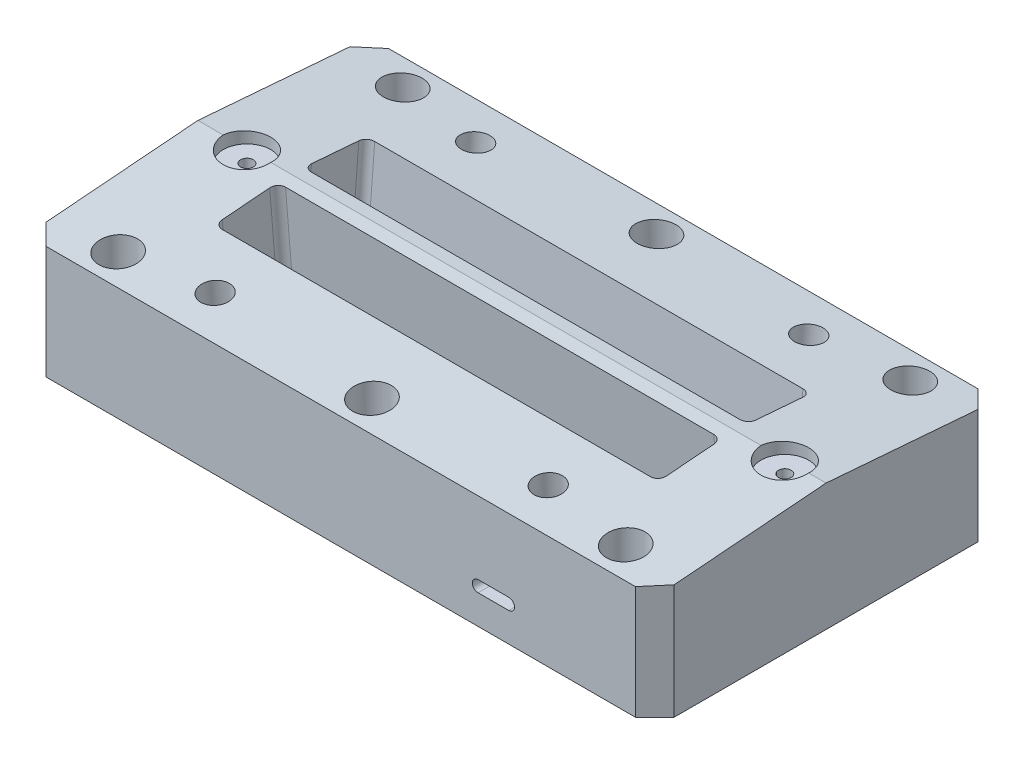
from build123d import *

# Parameters (mm, degrees)
SKETCH1_W            = 198
SKETCH1_H            = 108
BOSS_EXTRUDE1_DEPTH  = 40
SKETCH4_W            = 181
SKETCH4_H            = 45
CUT_EXTRUDE2_DEPTH   = 10
CUT_EXTRUDE3_START   = -198
CUT_EXTRUDE3_DEPTH   = 198
BOSS_EXTRUDE11_DEPTH = 10
CUT_EXTRUDE12_DEPTH  = 198
CUT_EXTRUDE28_DEPTH  = 14.5
CUT_EXTRUDE29_DEPTH  = 14.5
CUT_EXTRUDE40_REACH  = 231.059
SKETCH12_R           = 3.15
CUT_EXTRUDE9_DEPTH   = 230.058944379
SKETCH13_R           = 4.5
CUT_EXTRUDE10_DEPTH  = 16.5
SKETCH14_R           = 4.5
CUT_EXTRUDE11_DEPTH  = 16.5
SKETCH41_R           = 2.9
CUT_EXTRUDE21_DEPTH  = 7
CUT_EXTRUDE22_DEPTH  = 10
CUT_EXTRUDE23_DEPTH  = 10
CUT_EXTRUDE35_DEPTH  = 55.4
CUT_EXTRUDE34_DEPTH  = 55.4
CUT_EXTRUDE36_DEPTH  = 55.4
SKETCH90_R           = 6.1
CUT_EXTRUDE38_DEPTH  = 17
SKETCH96_R           = 2
CUT_EXTRUDE39_DEPTH  = 230.058944379
SKETCH98_R           = 7.5
CUT_EXTRUDE41_DEPTH  = 4


with BuildPart() as part:
    # Sketch1 → Boss-Extrude1 (new body)
    with BuildSketch(Plane(origin=(0, 0, 0), x_dir=(1, 0, 0), z_dir=(0, 1, 0))):
        with Locations((99, 54)):
            Rectangle(SKETCH1_W, SKETCH1_H)
    extrude(amount=BOSS_EXTRUDE1_DEPTH)

    # Sketch4 → Cut-Extrude2 (cut)
    with BuildSketch(Plane(origin=(0, 0, 0), x_dir=(1, 0, 0), z_dir=(0, 1, 0))):
        with Locations((99, 54)):
            Rectangle(SKETCH4_W, SKETCH4_H)
    extrude(amount=CUT_EXTRUDE2_DEPTH, mode=Mode.SUBTRACT)

    # Sketch5 → Cut-Extrude3 (cut)
    with BuildSketch(Plane(origin=(198, 0, 0), x_dir=(0, 0, -1), z_dir=(1, 0, 0)).offset(CUT_EXTRUDE3_START)):
        Polygon((54, 40), (108, 35.674234207), (108, 40), align=None)
    extrude(amount=CUT_EXTRUDE3_DEPTH, mode=Mode.SUBTRACT)

    # Sketch53 → Boss-Extrude11 (add)
    with BuildSketch(Plane(origin=(0, 10, 0), x_dir=(-1, 0, 0), z_dir=(0, -1, 0))):
        Polygon((-8.5, 51.5), (-8.5, 31.5), (-39.5, 31.5), align=None)
        Polygon((-8.5, 56.5), (-8.5, 76.5), (-39.5, 76.5), align=None)
        Polygon((-158.5, 76.5), (-189.5, 56.5), (-189.5, 76.5), align=None)
        Polygon((-158.5, 31.5), (-189.5, 51.5), (-189.5, 31.5), align=None)
    extrude(amount=BOSS_EXTRUDE11_DEPTH)

    # Sketch18 → Cut-Extrude12 (cut)
    with BuildSketch(Plane(origin=(198, 0, 0), x_dir=(0, 0, -1), z_dir=(1, 0, 0))):
        Polygon((0, 35.674234207), (0, 40), (54, 40), align=None)
    extrude(amount=-CUT_EXTRUDE12_DEPTH, mode=Mode.SUBTRACT)

    # Izq → Cut-Extrude28 (cut)
    with BuildSketch(Plane(origin=(0, 28.012686094, -12.204810084), x_dir=(1, 0, 0), z_dir=(0, 0.9167660546215652, -0.39942458749256926))):
        Polygon((8.5, 48.862182113), (29.5, 70.132603179), (8.5, 70.132603179), align=None)
    cut_extrude28 = extrude(amount=-CUT_EXTRUDE28_DEPTH, mode=Mode.SUBTRACT)

    # Der → Cut-Extrude29 (cut)
    with BuildSketch(Plane(origin=(0, -11.144923858, -4.62106599), x_dir=(1, 0, 0), z_dir=(0, 0.9237421135716327, 0.38301502270043264))):
        Polygon((8.5, 51.290217599), (29.5, 29.097876578), (8.5, 29.097876578), align=None)
    cut_extrude29 = extrude(amount=-CUT_EXTRUDE29_DEPTH, mode=Mode.SUBTRACT)

    # Cut-Extrude40: up to this face of the body (flat: up to its plane)
    cut_extrude40_end = Plane(part.part.faces().sort_by_distance((99, 10, -54))[0])
    # Sketch97 → Cut-Extrude40 (cut, up to the picked face)
    with BuildSketch(Plane(origin=(0, 0, 0), x_dir=(1, 0, 0), z_dir=(0, 1, 0)), mode=Mode.PRIVATE) as cut_extrude40_sk1:
        Polygon((8.5, 57.5), (29.5, 76.5), (158.5, 76.5), (189.5, 56.5), (189.5, 51.5), (158.5, 31.5), (29.5, 31.5), (8.5, 51.5), align=None)
    cut_extrude40_tool1 = split(extrude(cut_extrude40_sk1.sketch, amount=CUT_EXTRUDE40_REACH, mode=Mode.PRIVATE), bisect_by=cut_extrude40_end, keep=Keep.BOTH, mode=Mode.PRIVATE)
    cut_extrude40 = cut_extrude40_tool1.solids().sort_by(Axis((96.82024, 0, -54.014019), (0, 1, 0)))[0]
    add(cut_extrude40, mode=Mode.SUBTRACT)

    # Mirror2: Cut-Extrude28, Cut-Extrude29, Cut-Extrude40 across plane
    add(cut_extrude28.mirror(Plane(origin=(99, 0, 0), x_dir=(0, 0, 1), z_dir=(1, 0, 0))), mode=Mode.SUBTRACT)
    add(cut_extrude29.mirror(Plane(origin=(99, 0, 0), x_dir=(0, 0, 1), z_dir=(1, 0, 0))), mode=Mode.SUBTRACT)
    add(cut_extrude40.mirror(Plane(origin=(99, 0, 0), x_dir=(0, 0, 1), z_dir=(1, 0, 0))), mode=Mode.SUBTRACT)

    # Sketch12 → Cut-Extrude9 (cut, through all)
    with BuildSketch(Plane(origin=(0, 40, 0), x_dir=(1, 0, 0), z_dir=(0, 1, 0))):
        with Locations(Location((19.7, 98.85, 0), (0, 0, 270))):
            Circle(SKETCH12_R)
        with Locations(Location((99.7, 9.15, 0), (0, 0, 270))):
            Circle(SKETCH12_R)
        with Locations(Location((179.7, 9.15, 0), (0, 0, 270))):
            Circle(SKETCH12_R)
        with Locations(Location((19.7, 9.15, 0), (0, 0, 270))):
            Circle(SKETCH12_R)
        with Locations(Location((99.7, 98.85, 0), (0, 0, 270))):
            Circle(SKETCH12_R)
        with Locations(Location((179.7, 98.85, 0), (0, 0, 270))):
            Circle(SKETCH12_R)
    extrude(amount=-CUT_EXTRUDE9_DEPTH, mode=Mode.SUBTRACT)

    # Sketch13 → Cut-Extrude10 (cut)
    with BuildSketch(Plane(origin=(0, 44.04313679, -3.528153602), x_dir=(1, 0, 0), z_dir=(0, 0.9968068124341598, -0.07985097798305206))):
        with Locations(Location((46.5, 91.806513253, 0), (0, 0, 270))):
            Circle(SKETCH13_R)
        with Locations(Location((151.5, 91.806513253, 0), (0, 0, 270))):
            Circle(SKETCH13_R)
    extrude(amount=-CUT_EXTRUDE10_DEPTH, mode=Mode.SUBTRACT)

    # Sketch14 → Cut-Extrude11 (cut)
    with BuildSketch(Plane(origin=(0, 35.212287021, 5.766643233), x_dir=(1, 0, 0), z_dir=(0, 0.9968068124341597, 0.07985097798305243))):
        with Locations(Location((46.5, 18.739607443, 0), (0, 0, 270))):
            Circle(SKETCH14_R)
        with Locations(Location((151.5, 18.739607443, 0), (0, 0, 270))):
            Circle(SKETCH14_R)
    extrude(amount=-CUT_EXTRUDE11_DEPTH, mode=Mode.SUBTRACT)

    # Sketch41 → Cut-Extrude21 (cut)
    with BuildSketch(Plane(origin=(0, 0, 0), x_dir=(1, 0, 0), z_dir=(0, 1, 0))):
        with Locations(Location((139.5, 9, 0), (0, 0, 90))):
            Circle(SKETCH41_R)
        with Locations(Location((139.5, 99, 0), (0, 0, 90))):
            Circle(SKETCH41_R)
    extrude(amount=CUT_EXTRUDE21_DEPTH, mode=Mode.SUBTRACT)

    # Sketch42 → Cut-Extrude22 (cut)
    with BuildSketch(Plane.XY):
        with BuildLine():
            Line((142.3, 12.8), (152, 12.8))
            ThreePointArc((152, 12.8), (153.8, 11), (152, 9.2))
            Line((152, 9.2), (142.3, 9.2))
            ThreePointArc((142.3, 9.2), (140.5, 11), (142.3, 12.8))
        make_face()
    extrude(amount=-CUT_EXTRUDE22_DEPTH, mode=Mode.SUBTRACT)

    # Sketch43 → Cut-Extrude23 (cut)
    with BuildSketch(Plane(origin=(0, 0, -108), x_dir=(-1, 0, 0), z_dir=(0, 0, -1))):
        with BuildLine():
            Line((-55.7, 12.8), (-46, 12.8))
            ThreePointArc((-46, 12.8), (-44.2, 11), (-46, 9.2))
            Line((-46, 9.2), (-55.7, 9.2))
            ThreePointArc((-55.7, 9.2), (-57.5, 11), (-55.7, 12.8))
        make_face()
    extrude(amount=-CUT_EXTRUDE23_DEPTH, mode=Mode.SUBTRACT)

    # Sketch84 → Cut-Extrude35 (cut)
    with BuildSketch(Plane(origin=(0, 44.04313679, -3.528153602), x_dir=(1, 0, 0), z_dir=(0, 0.9968068124341598, -0.07985097798305206))):
        with BuildLine():
            Line((31.7, 54.733528752), (166.7, 54.733528752))
            ThreePointArc((166.7, 54.733528752), (168.467766953, 55.465761799), (169.2, 57.233528752))
            Line((169.2, 57.233528752), (169.2, 72.233528752))
            ThreePointArc((169.2, 72.233528752), (168.467766953, 74.001295705), (166.7, 74.733528752))
            Line((166.7, 74.733528752), (31.7, 74.733528752))
            ThreePointArc((31.7, 74.733528752), (29.932233047, 74.001295705), (29.2, 72.233528752))
            Line((29.2, 72.233528752), (29.2, 57.233528752))
            ThreePointArc((29.2, 57.233528752), (29.932233047, 55.465761799), (31.7, 54.733528752))
        make_face()
    extrude(amount=-CUT_EXTRUDE35_DEPTH, mode=Mode.SUBTRACT)

    # Sketch83 → Cut-Extrude34 (cut)
    with BuildSketch(Plane(origin=(0, 35.446768916, 2.839526304), x_dir=(1, 0, 0), z_dir=(0, 0.9968068124341598, 0.07985097798305245))):
        with BuildLine():
            Line((31.7, 52.921606991), (166.7, 52.921606991))
            ThreePointArc((166.7, 52.921606991), (168.467766953, 52.189373944), (169.2, 50.421606991))
            Line((169.2, 50.421606991), (169.2, 35.421606991))
            ThreePointArc((169.2, 35.421606991), (168.467766953, 33.653840038), (166.7, 32.921606991))
            Line((166.7, 32.921606991), (31.7, 32.921606991))
            ThreePointArc((31.7, 32.921606991), (29.932233047, 33.653840038), (29.2, 35.421606991))
            Line((29.2, 35.421606991), (29.2, 50.421606991))
            ThreePointArc((29.2, 50.421606991), (29.932233047, 52.189373944), (31.7, 52.921606991))
        make_face()
    extrude(amount=-CUT_EXTRUDE34_DEPTH, mode=Mode.SUBTRACT)

    # Sketch85 → Cut-Extrude36 (cut)
    with BuildSketch(Plane(origin=(0, 40, 0), x_dir=(1, 0, 0), z_dir=(0, 1, 0))):
        Polygon((0, 101.9), (6.1, 108), (0, 108), align=None)
        Polygon((0, 0), (6.1, 0), (0, 6.1), align=None)
        Polygon((198, 6.1), (191.9, 0), (198, 0), align=None)
        Polygon((198, 108), (191.9, 108), (198, 101.9), align=None)
    extrude(amount=-CUT_EXTRUDE36_DEPTH, mode=Mode.SUBTRACT)

    # Sketch90 → Cut-Extrude38 (cut)
    with BuildSketch(Plane(origin=(0, 40, 0), x_dir=(1, 0, 0), z_dir=(0, 1, 0))):
        with Locations(Location((19.7, 9.15, 0), (0, 0, 270))):
            Circle(SKETCH90_R)
        with Locations(Location((99.7, 9.15, 0), (0, 0, 270))):
            Circle(SKETCH90_R)
        with Locations(Location((179.7, 9.15, 0), (0, 0, 270))):
            Circle(SKETCH90_R)
        with Locations(Location((99.7, 98.85, 0), (0, 0, 270))):
            Circle(SKETCH90_R)
        with Locations(Location((179.7, 98.85, 0), (0, 0, 270))):
            Circle(SKETCH90_R)
        with Locations(Location((19.7, 98.85, 0), (0, 0, 270))):
            Circle(SKETCH90_R)
    extrude(amount=-CUT_EXTRUDE38_DEPTH, mode=Mode.SUBTRACT)

    # Sketch96 → Cut-Extrude39 (cut, through all)
    with BuildSketch(Plane(origin=(0, 0, 0), x_dir=(1, 0, 0), z_dir=(0, 1, 0))):
        with Locations(Location((15.45, 54, 0), (0, 0, 180))):
            Circle(SKETCH96_R)
        with Locations((185, 54)):
            Circle(SKETCH96_R)
    extrude(amount=CUT_EXTRUDE39_DEPTH, mode=Mode.SUBTRACT)

    # Sketch98 → Cut-Extrude41 (cut)
    with BuildSketch(Plane(origin=(0, 40, 0), x_dir=(1, 0, 0), z_dir=(0, 1, 0))):
        with Locations(Location((185, 54, 0), (0, 0, 270))):
            Circle(SKETCH98_R)
        with Locations(Location((15.45, 54, 0), (0, 0, 270))):
            Circle(SKETCH98_R)
    extrude(amount=-CUT_EXTRUDE41_DEPTH, mode=Mode.SUBTRACT)


solid = part.part
